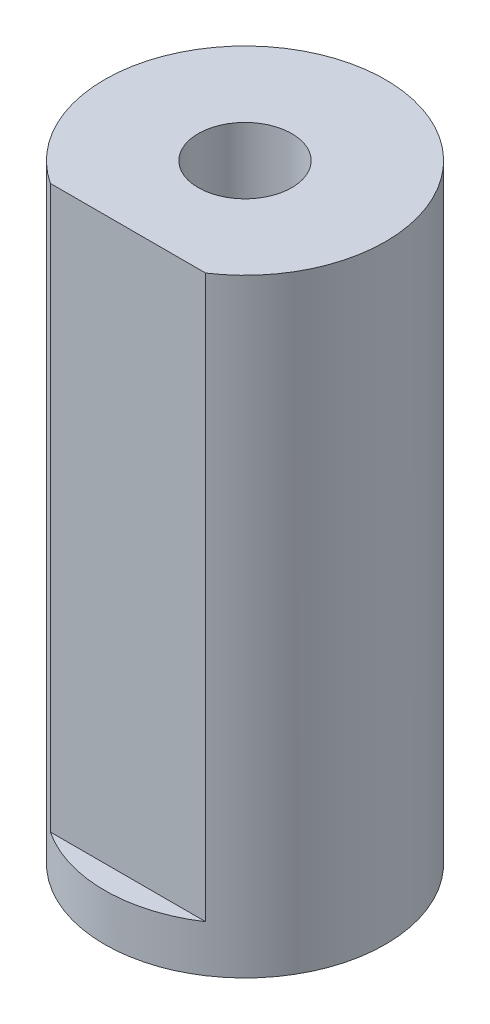
from build123d import *

# Parameters (mm, degrees)
SKETCH1_R           = 3
BOSS_EXTRUDE1_DEPTH = 13
SKETCH2_R           = 1
CUT_EXTRUDE1_DEPTH  = 13
CUT_EXTRUDE2_DEPTH  = 12


with BuildPart() as part:
    # Sketch1 → Boss-Extrude1 (new body)
    with BuildSketch(Plane(origin=(0, 0, 0), x_dir=(1, 0, 0), z_dir=(0, 1, 0))):
        with Locations(Location((0, 0, 0), (0, 0, 90))):
            Circle(SKETCH1_R)
    extrude(amount=BOSS_EXTRUDE1_DEPTH)

    # Sketch2 → Cut-Extrude1 (cut)
    with BuildSketch(Plane(origin=(0, 13, 0), x_dir=(1, 0, 0), z_dir=(0, 1, 0))):
        with Locations(Location((0, 0, 0), (0, 0, 270))):
            Circle(SKETCH2_R)
    extrude(amount=-CUT_EXTRUDE1_DEPTH, mode=Mode.SUBTRACT)

    # Sketch3 → Cut-Extrude2 (cut)
    with BuildSketch(Plane(origin=(0, 13, 0), x_dir=(1, 0, 0), z_dir=(0, 1, 0))):
        Polygon((26.073564647, -2.5), (1.658312395, -2.5), (-1.658312395, -2.5), (-26.073564647, -2.5), (-26.073564647, -51.330504504), (26.073564647, -51.330504504), align=None)
    extrude(amount=-CUT_EXTRUDE2_DEPTH, mode=Mode.SUBTRACT)


solid = part.part
